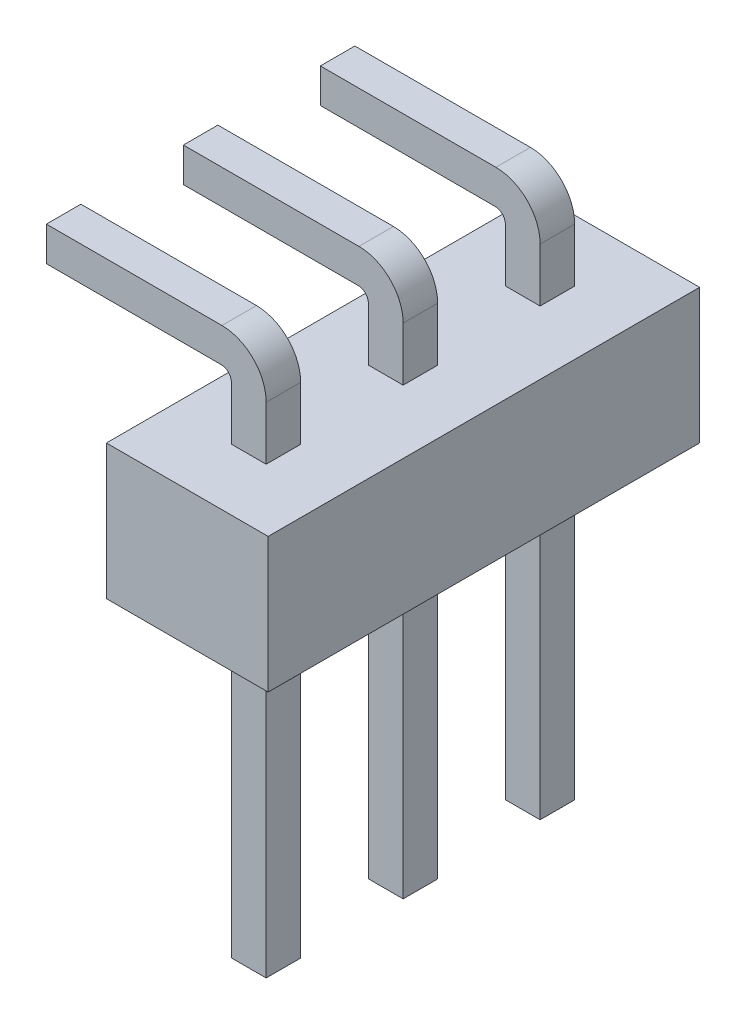
from build123d import *

# Parameters (mm, degrees)
SKETCH1_W       = 3
SKETCH1_H       = 2.5
EXTRUDE1_DEPTH  = 4
SKETCH2_W       = 0.645
SKETCH2_H       = 6
EXTRUDE2_DEPTH  = 0.64
LPATTERN1_COUNT = 3
LPATTERN1_PITCH = 2.54
CHAMFER1_SIZE   = 0.25


with BuildPart() as part:
    # Sketch1 → Extrude1 (new, symmetric)
    with BuildSketch(Plane.XY):
        Rectangle(SKETCH1_W, SKETCH1_H)
    extrude(amount=EXTRUDE1_DEPTH, both=True)

    # Sketch2 → Extrude2 (add)
    with BuildSketch(Plane.XY.offset(2.86)):
        with BuildLine():
            Line((-0.3225, 1.25), (-0.3225, 2.245))
            ThreePointArc((-0.3225, 2.245), (-0.374776878, 2.375), (-0.5025, 2.43261663))
            Line((-0.5025, 2.43261663), (-4.0025, 2.43261663))
            Line((-4.0025, 2.43261663), (-4.0025, 3.06831282))
            Line((-4.0025, 3.06831282), (-0.4975, 3.06831282))
            ThreePointArc((-0.4975, 3.06831282), (0.082527742, 2.826), (0.3225, 2.245))
            Line((0.3225, 2.245), (0.3225, 1.25))
            Line((0.3225, 1.25), (-0.3225, 1.25))
        make_face()
        with Locations((0, -4.25)):
            Rectangle(SKETCH2_W, SKETCH2_H)
    extrude2 = extrude(amount=-EXTRUDE2_DEPTH)

    # LPattern1: Extrude2 ×3
    with Locations(*[(0, 0, -i * LPATTERN1_PITCH) for i in range(1, LPATTERN1_COUNT)]):
        add(extrude2)

    # Chamfer1
    chamfer1_edges = [part.edges().sort_by_distance(p)[0] for p in [
        (-4.0025, 2.750464725, 2.22),
        (-4.0025, 2.43261663, 2.54),
        (-4.0025, 3.06831282, 2.54),
        (-4.0025, 2.750464725, 2.86),
        (0, -7.25, 2.22),
        (0.3225, -7.25, 2.54),
        (-0.3225, -7.25, 2.54),
        (0, -7.25, 2.86),
        (-4.0025, 2.750464725, -0.32),
        (-4.0025, 2.43261663, 0),
        (-4.0025, 3.06831282, 0),
        (-4.0025, 2.750464725, 0.32),
        (0, -7.25, -0.32),
        (0.3225, -7.25, 0),
        (-0.3225, -7.25, 0),
        (0, -7.25, 0.32),
        (-4.0025, 2.750464725, -2.86),
        (-4.0025, 2.43261663, -2.54),
        (-4.0025, 3.06831282, -2.54),
        (-4.0025, 2.750464725, -2.22),
        (0, -7.25, -2.86),
        (0.3225, -7.25, -2.54),
        (-0.3225, -7.25, -2.54),
        (0, -7.25, -2.22),
    ]]
    chamfer(chamfer1_edges, length=CHAMFER1_SIZE)


solid = part.part
